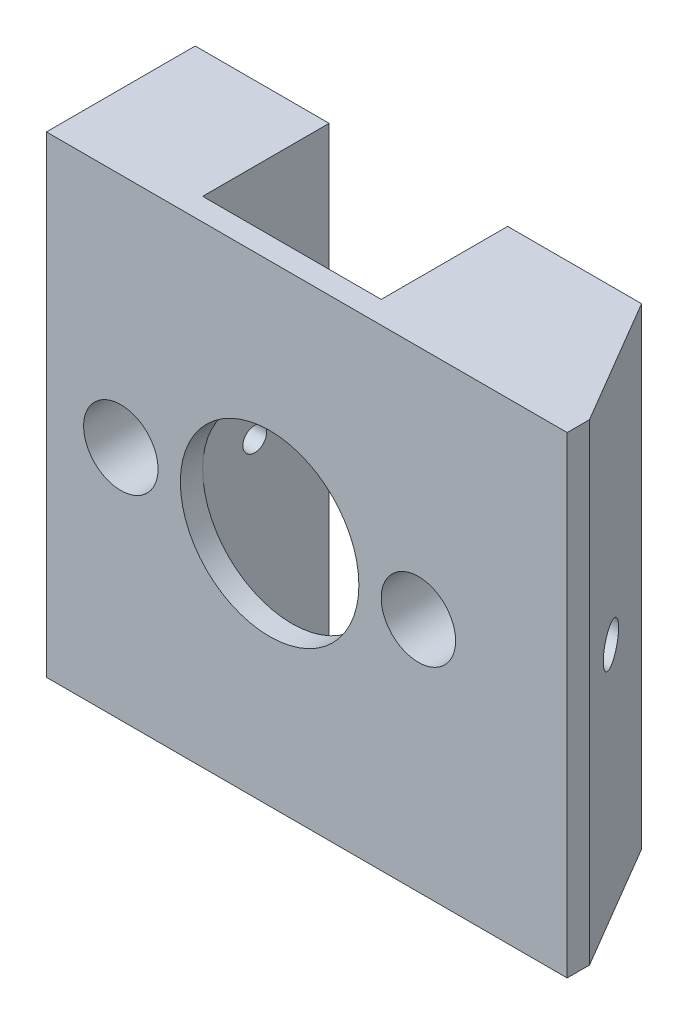
from build123d import *

# Parameters (mm, degrees)
SKETCH_1_W          = 18
SKETCH_1_H          = 63.5
SKETCH_1_R          = 5
EXTRUDE_1_DEPTH     = 17
EXTRUDE_1_2_DEPTH   = 17
SKETCH_2_W          = 60
SKETCH_2_H          = 63.5
SKETCH_2_R          = 5
SKETCH_2_R_2        = 12
EXTRUDE_2_DEPTH     = 3
SKETCH_3_W          = 3
SKETCH_3_H          = 63.5
EXTRUDE_3_DEPTH     = 10
RIB_1_REACH         = 88.355
SKETCH_4_WALL_W     = 194.433823758
SKETCH_4_WALL_H     = 63.5
SKETCH_7_W          = 3
SKETCH_7_H          = 7
CUT_EXTRUDE_1_DEPTH = 3.5
HOLE_WIZARD_1_D     = 3.2
SKETCH_13_R         = 2.5
CUT_EXTRUDE_2_DEPTH = 11
SKETCH_14_W         = 2
SKETCH_14_H         = 35
CUT_EXTRUDE_3_DEPTH = 1


with BuildPart() as part:
    # 草图1 → 凸台-拉伸1 (new body)
    with BuildSketch(Plane.XY):
        with Locations((36, 49.25)):
            Rectangle(SKETCH_1_W, SKETCH_1_H)
        with Locations((35, 49.25)):
            Circle(SKETCH_1_R, mode=Mode.SUBTRACT)
    extrude(amount=EXTRUDE_1_DEPTH)



with BuildPart() as body_2:
    # 草图1 → Extrude 1 2 (new body)
    with BuildSketch(Plane.XY):
        with Locations((-6, 49.25)):
            Rectangle(SKETCH_1_W, SKETCH_1_H)
        with Locations((-5, 49.25)):
            Circle(SKETCH_1_R, mode=Mode.SUBTRACT)
    extrude(amount=EXTRUDE_1_2_DEPTH)


with BuildPart() as part_1:
    add(part.part)

    add(body_2.part)  # 凸台-拉伸2 merges body 2
    # 草图2 → 凸台-拉伸2 (add)
    with BuildSketch(Plane.XY.offset(17)):
        with Locations((15, 49.25)):
            Rectangle(SKETCH_2_W, SKETCH_2_H)
        with Locations((35, 49.25)):
            Circle(SKETCH_2_R, mode=Mode.SUBTRACT)
        with Locations((-5, 49.25)):
            Circle(SKETCH_2_R, mode=Mode.SUBTRACT)
        with Locations((15, 49.25)):
            Circle(SKETCH_2_R_2, mode=Mode.SUBTRACT)
    extrude(amount=EXTRUDE_2_DEPTH)

    # 草图3 → 凸台-拉伸3 (add)
    with BuildSketch(Plane(origin=(45, 0, 0), x_dir=(0, 0, -1), z_dir=(1, 0, 0))):
        with Locations((-18.5, 49.25)):
            Rectangle(SKETCH_3_W, SKETCH_3_H)
    extrude(amount=EXTRUDE_3_DEPTH)

    # 草图4 wall → 筋1 (add, up to next)
    with BuildSketch(Plane(origin=(50, 17.5, 8.5), x_dir=(-0.507020126563, 0, -0.861934215158), z_dir=(0.861934215158, 0, -0.507020126563)), mode=Mode.PRIVATE) as rib_1_sk1:
        with Locations((0, 31.75)):
            Rectangle(SKETCH_4_WALL_W, SKETCH_4_WALL_H)
    rib_1_tool1 = extrude(rib_1_sk1.sketch, amount=-RIB_1_REACH, mode=Mode.PRIVATE) - part_1.part
    add(rib_1_tool1.solids().sort_by_distance((50, 17.5, 8.5))[0])

    # 草图7 → 切除-拉伸1 (cut, symmetric)
    with BuildSketch(Plane.XY.offset(10)):
        with Locations((-12.5, 49.25)):
            Rectangle(SKETCH_7_W, SKETCH_7_H)
        with Locations((42.5, 49.25)):
            Rectangle(SKETCH_7_W, SKETCH_7_H)
    extrude(amount=CUT_EXTRUDE_1_DEPTH, both=True, mode=Mode.SUBTRACT)

    # 孔1 (through all)
    with Locations(Plane.ZY.offset(15)):
        with Locations((10, 49.25)):
            Hole(HOLE_WIZARD_1_D / 2)

    # 草图13 → 切除-拉伸2 (cut)
    with BuildSketch(Plane.ZY.offset(-47)):
        with Locations((10, 49.25)):
            Circle(SKETCH_13_R)
    extrude(amount=-CUT_EXTRUDE_2_DEPTH, mode=Mode.SUBTRACT)

    # 草图14 → 切除-拉伸3 (cut)
    with BuildSketch(Plane.ZY.offset(15)):
        with Locations((0, 49.25)):
            Rectangle(SKETCH_14_W, SKETCH_14_H)
    extrude(amount=-CUT_EXTRUDE_3_DEPTH, mode=Mode.SUBTRACT)


solid = part_1.part
